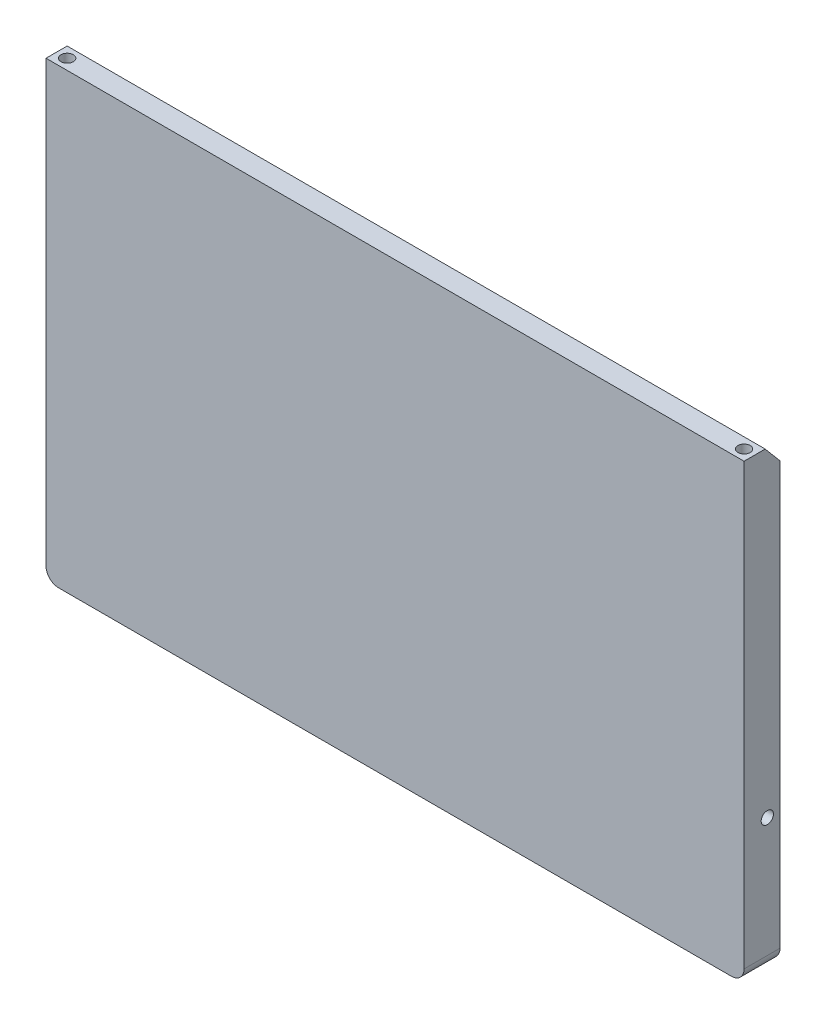
from build123d import *

# Parameters (mm, degrees)
SKETCH1_W           = 165.1
SKETCH1_H           = 90
BOSS_EXTRUDE1_DEPTH = 5
SKETCH2_R           = 1.45
CUT_EXTRUDE1_DEPTH  = 7
SKETCH4_W           = 165.1
SKETCH4_H           = 90
BOSS_EXTRUDE2_DEPTH = 3.5
CHAMFER1_SIZE       = 3.5
CHAMFER1_SIZE2      = 4.171137574
SKETCH5_W           = 100.2
SKETCH5_H           = 79.2
CUT_EXTRUDE3_DEPTH  = 6.5
SKETCH8_R           = 1.45
CUT_EXTRUDE5_DEPTH  = 3
SKETCH10_W          = 165.1
SKETCH10_H          = 8.5
BOSS_EXTRUDE4_DEPTH = 17
FILLET1_R           = 3


with BuildPart() as part:
    # Sketch1 → Boss-Extrude1 (new body)
    with BuildSketch(Plane.XY):
        with Locations((0, -35.801949153)):
            Rectangle(SKETCH1_W, SKETCH1_H)
    extrude(amount=BOSS_EXTRUDE1_DEPTH)

    # Sketch2 → Cut-Extrude1 (cut)
    with BuildSketch(Plane(origin=(0, 9.198050847, 0), x_dir=(1, 0, 0), z_dir=(0, 1, 0))):
        with Locations(Location((-80.05, -2.5, 0), (0, 0, 270))):
            Circle(SKETCH2_R)
        with Locations(Location((80.05, -2.5, 0), (0, 0, 270))):
            Circle(SKETCH2_R)
    extrude(amount=-CUT_EXTRUDE1_DEPTH, mode=Mode.SUBTRACT)

    # Sketch4 → Boss-Extrude2 (add)
    with BuildSketch(Plane(origin=(0, 0, 0), x_dir=(-1, 0, 0), z_dir=(0, 0, -1))):
        with Locations((0, -35.801949153)):
            Rectangle(SKETCH4_W, SKETCH4_H)
    extrude(amount=BOSS_EXTRUDE2_DEPTH)

    # Chamfer1
    chamfer1_edges = [part.edges().sort_by_distance(p)[0] for p in [
        (0, 9.198050847, -3.5),
    ]]
    chamfer1_side = [part.faces().sort_by_distance(p)[0] for p in [
        (0, 9.198050847, 0.733369875),
    ]]
    chamfer(chamfer1_edges, length=CHAMFER1_SIZE, length2=CHAMFER1_SIZE2, reference=chamfer1_side[0])

    # Sketch5 → Cut-Extrude3 (cut)
    with BuildSketch(Plane(origin=(0, 0, -3.5), x_dir=(-1, 0, 0), z_dir=(0, 0, -1))):
        with Locations((0, -35.801949153)):
            Rectangle(SKETCH5_W, SKETCH5_H)
    extrude(amount=-CUT_EXTRUDE3_DEPTH, mode=Mode.SUBTRACT)

    # Sketch8 → Cut-Extrude5 (cut)
    with BuildSketch(Plane(origin=(82.55, 0, 0), x_dir=(0, 0, -1), z_dir=(1, 0, 0))):
        with Locations((0.5, -66.551949153)):
            Circle(SKETCH8_R)
    cut_extrude5 = extrude(amount=-CUT_EXTRUDE5_DEPTH, mode=Mode.SUBTRACT)

    # Mirror2: Cut-Extrude5 across plane
    add(cut_extrude5.mirror(Plane(origin=(0, 0, 0), x_dir=(0, 0, 1), z_dir=(1, 0, 0))), mode=Mode.SUBTRACT)

    # Sketch10 → Boss-Extrude4 (add)
    with BuildSketch(Plane.XZ.offset(80.801949153)):
        with Locations((0, 0.75)):
            Rectangle(SKETCH10_W, SKETCH10_H)
    extrude(amount=BOSS_EXTRUDE4_DEPTH)

    # Fillet1
    fillet1_edges = [part.edges().sort_by_distance(p)[0] for p in [
        (-82.55, -97.801949153, 0.75),
        (82.55, -97.801949153, 0.75),
    ]]
    fillet(fillet1_edges, radius=FILLET1_R)


solid = part.part
